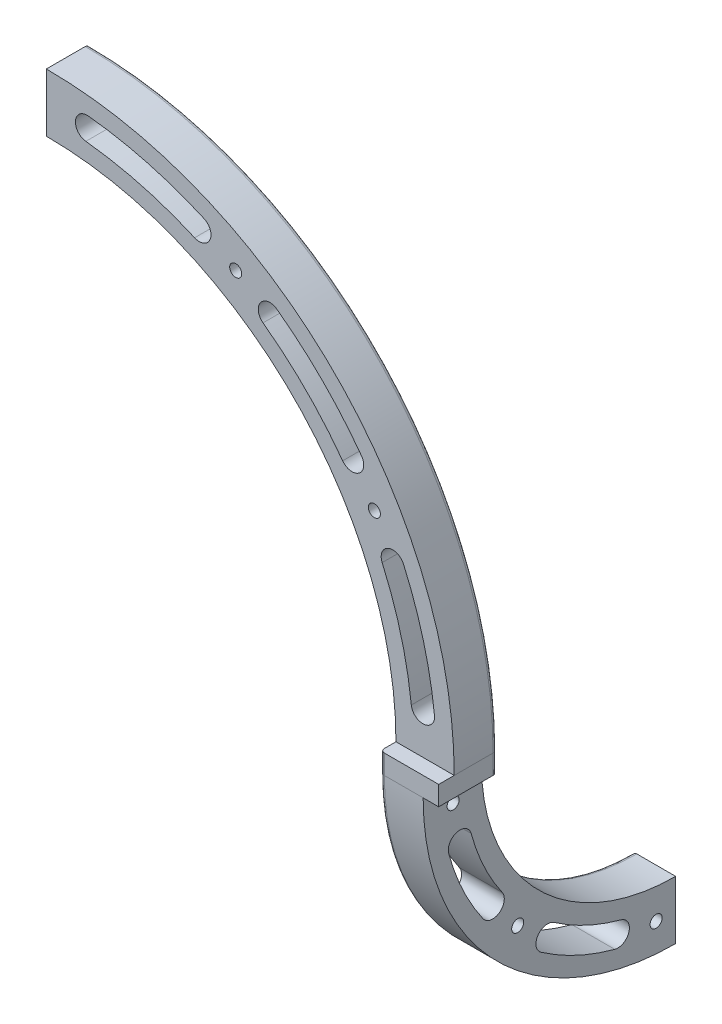
from build123d import *

# Parameters (mm, degrees)
EXTRUDE_1_DEPTH     = 15
SKETCH_2_W          = 15
SKETCH_2_H          = 15
EXTRUDE_2_DEPTH     = 5
EXTRUDE_3_DEPTH     = 15
SKETCH_4_R          = 1.55
CUT_EXTRUDE_1_DEPTH = 163.095650774
SKETCH_5_R          = 1.55
CUT_EXTRUDE_2_DEPTH = 157.68439616
CUT_EXTRUDE_3_DEPTH = 4
CUT_EXTRUDE_START   = -4
CUT_EXTRUDE_4_DEPTH = 4
FILLET_1_R          = 1


with BuildPart() as part:
    # 草图1 → 凸台-拉伸1 (new body)
    with BuildSketch(Plane.XY):
        with BuildLine():
            Line((90, 0), (105, 0))
            ThreePointArc((105, 0), (74.246212025, 74.246212025), (0, 105))
            Line((0, 105), (0, 90))
            ThreePointArc((0, 90), (63.639610307, 63.639610307), (90, 0))
        make_face()
    extrude(amount=EXTRUDE_1_DEPTH)

    # 草图2 → 凸台-拉伸2 (add)
    with BuildSketch(Plane.XZ):
        with Locations((97.5, 7.5)):
            Rectangle(SKETCH_2_W, SKETCH_2_H)
    extrude(amount=EXTRUDE_2_DEPTH)

    # 草图3 → 凸台-拉伸3 (add)
    with BuildSketch(Plane(origin=(105, 0, 0), x_dir=(0, 0, -1), z_dir=(1, 0, 0))):
        with BuildLine():
            Line((50, -55), (50, -70))
            ThreePointArc((50, -70), (4.038059223, -50.961940777), (-15, -5))
            Line((-15, -5), (0, -5))
            ThreePointArc((0, -5), (14.644660941, -40.355339059), (50, -55))
        make_face()
    extrude(amount=-EXTRUDE_3_DEPTH)

    # 草图4 → 切除-拉伸1 (cut, through all)
    with BuildSketch(Plane.XY.offset(15)):
        with Locations((84.437476869, 48.75)):
            Circle(SKETCH_4_R)
        with Locations((48.75, 84.437476869)):
            Circle(SKETCH_4_R)
        with BuildLine():
            ThreePointArc((40.593936087, 91.936838933), (26.011314033, 97.075545542), (10.813039575, 99.916606103))
            ThreePointArc((10.813039575, 99.916606103), (7.507677018, 97.256798147), (10.167484974, 93.951435589))
            ThreePointArc((10.167484974, 93.951435589), (24.458399762, 91.279990584), (38.170417515, 86.448072429))
            ThreePointArc((38.170417515, 86.448072429), (42.126560053, 87.980696395), (40.593936087, 91.936838933))
        make_face()
        with BuildLine():
            ThreePointArc((81.123799357, 59.322670016), (71.064231509, 71.064231509), (59.322670016, 81.123799357))
            ThreePointArc((59.322670016, 81.123799357), (55.130238094, 80.473019377), (55.781018075, 76.280587456))
            ThreePointArc((55.781018075, 76.280587456), (66.821590822, 66.821590822), (76.280587456, 55.781018075))
            ThreePointArc((76.280587456, 55.781018075), (80.473019377, 55.130238094), (81.123799357, 59.322670016))
        make_face()
        with BuildLine():
            ThreePointArc((99.916606103, 10.813039575), (97.075545542, 26.011314033), (91.936838933, 40.593936087))
            ThreePointArc((91.936838933, 40.593936087), (87.980696395, 42.126560053), (86.448072429, 38.170417515))
            ThreePointArc((86.448072429, 38.170417515), (91.279990584, 24.458399762), (93.951435589, 10.167484974))
            ThreePointArc((93.951435589, 10.167484974), (97.256798147, 7.507677018), (99.916606103, 10.813039575))
        make_face()
    extrude(amount=-CUT_EXTRUDE_1_DEPTH, mode=Mode.SUBTRACT)

    # 草图5 → 切除-拉伸2 (cut, through all)
    with BuildSketch(Plane(origin=(105, 0, 0), x_dir=(0, 0, -1), z_dir=(1, 0, 0))):
        with Locations((44.969401847, -62.5)):
            Circle(SKETCH_5_R)
        with Locations((9.341360082, -45.658639918)):
            Circle(SKETCH_5_R)
        with Locations((-7.28119514, -10.011455208)):
            Circle(SKETCH_5_R)
        with BuildLine():
            ThreePointArc((-8.432245014, -20.681924073), (-4.831621116, -30.568404835), (0.427426106, -39.681550102))
            ThreePointArc((0.427426106, -39.681550102), (4.605316552, -40.419947976), (5.343714426, -36.24205753))
            ThreePointArc((5.343714426, -36.24205753), (0.606225607, -28.032695265), (-2.637311624, -19.126691933))
            ThreePointArc((-2.637311624, -19.126691933), (-6.312394389, -17.006841308), (-8.432245014, -20.681924073))
        make_face()
        with BuildLine():
            ThreePointArc((15.318449898, -54.572573894), (24.431595165, -59.831621116), (34.318075927, -63.432245014))
            ThreePointArc((34.318075927, -63.432245014), (37.993158692, -61.312394389), (35.873308067, -57.637311624))
            ThreePointArc((35.873308067, -57.637311624), (26.967304735, -54.393774393), (18.75794247, -49.656285574))
            ThreePointArc((18.75794247, -49.656285574), (14.580052024, -50.394683448), (15.318449898, -54.572573894))
        make_face()
    extrude(amount=-CUT_EXTRUDE_2_DEPTH, mode=Mode.SUBTRACT)

    # 草图6 → 切除-拉伸3 (cut)
    with BuildSketch(Plane(origin=(105, 0, 0), x_dir=(0, 0, -1), z_dir=(1, 0, 0))):
        with BuildLine():
            Line((50, -55), (50, -70))
            ThreePointArc((50, -70), (4.038059223, -50.961940777), (-15, -5))
            Line((-15, -5), (0, -5))
            ThreePointArc((0, -5), (14.644660941, -40.355339059), (50, -55))
        make_face()
    extrude(amount=-CUT_EXTRUDE_3_DEPTH, mode=Mode.SUBTRACT)

    # 草图7 → 切除-拉伸4 (cut)
    with BuildSketch(Plane.XY.offset(15).offset(CUT_EXTRUDE_START)):
        with BuildLine():
            Line((0, 105), (0, 90))
            ThreePointArc((0, 90), (63.639610307, 63.639610307), (90, 0))
            Line((90, 0), (105, 0))
            ThreePointArc((105, 0), (74.246212025, 74.246212025), (0, 105))
        make_face()
    extrude(amount=CUT_EXTRUDE_4_DEPTH, mode=Mode.SUBTRACT)

    # 圆角1
    fillet_1_edges = [part.edges().sort_by_distance(p)[0] for p in [
        (90, -2.5, 15),
        (90, -2.5, 0),
        (105, -2.5, 0),
        (90, -40.355339059, -14.644660941),
        (90, -50.961940777, -4.038059223),
        (63.639610307, 63.639610307, 0),
        (74.246212025, 74.246212025, 0),
    ]]
    fillet(fillet_1_edges, radius=FILLET_1_R)


solid = part.part
